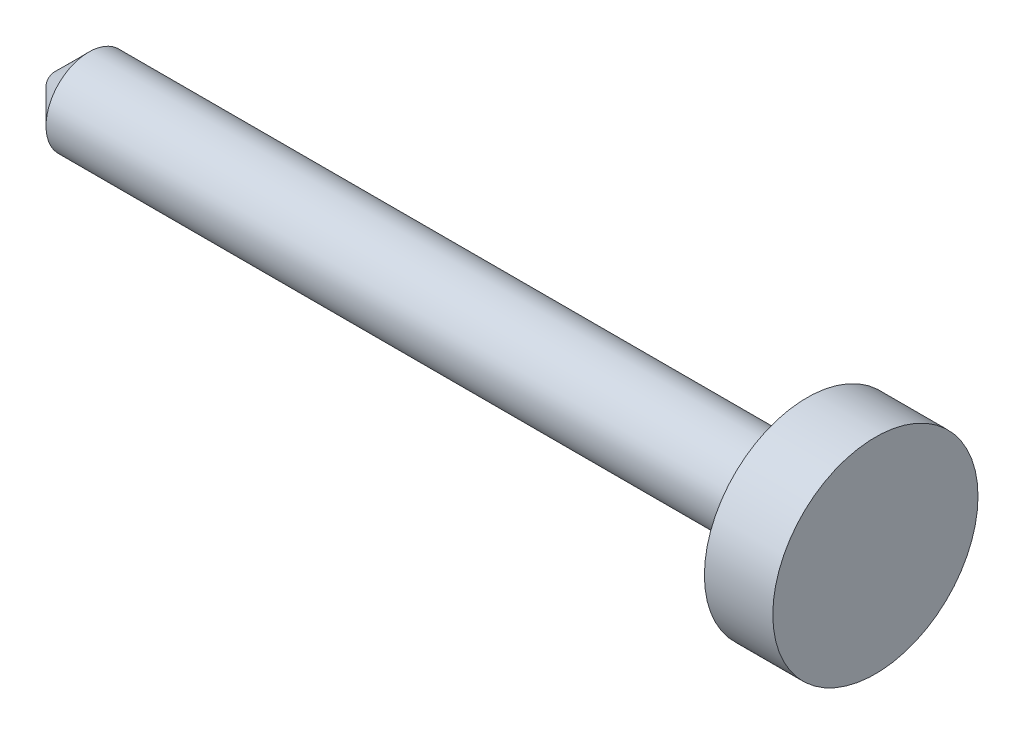
from build123d import *

# Parameters (mm, degrees)
CHAMFER2_SIZE = 1


with BuildPart() as part:
    # Sketch1 → Revolve1 (revolve)
    with BuildSketch(Plane.XY, mode=Mode.PRIVATE) as revolve1_sk:
        Polygon((-16.462962963, 0), (-16.462962963, 1.25), (5.537037037, 1.25), (5.537037037, 3), (7.537037037, 3), (7.537037037, 0), align=None)
    revolve(revolve1_sk.sketch.rotate(Axis((-16.462962963, 0, 0), (1, 0, 0)), 90), axis=Axis((-16.462962963, 0, 0), (1, 0, 0)))

    # Chamfer2
    chamfer2_edges = [part.edges().sort_by_distance(p)[0] for p in [
        (-16.462962963, 0, -1.25),
    ]]
    chamfer(chamfer2_edges, length=CHAMFER2_SIZE)


solid = part.part
